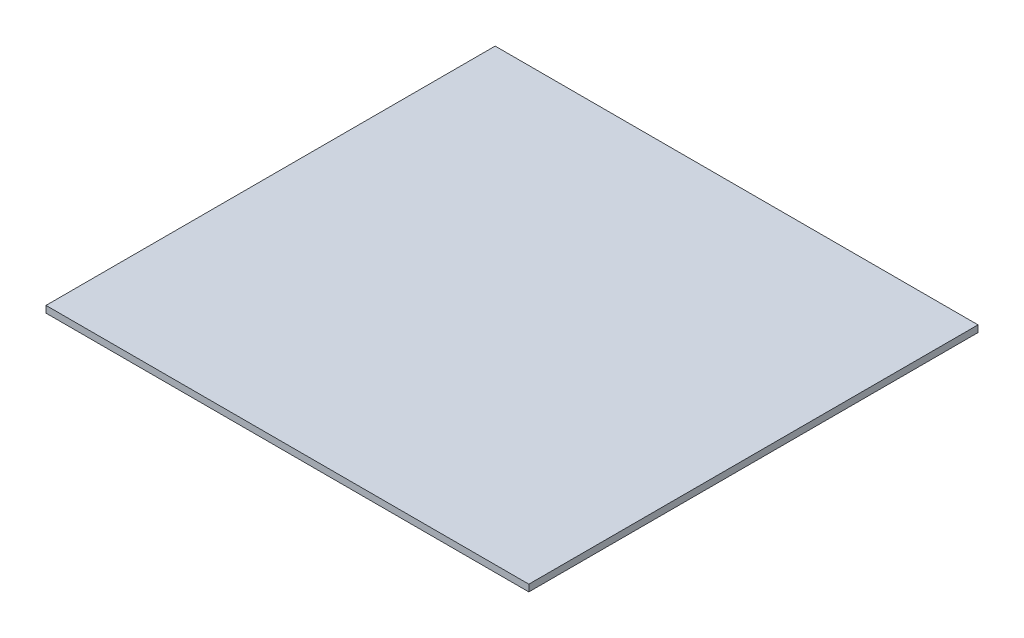
from build123d import *

# Parameters (mm, degrees)
SKETCH1_W           = 430
SKETCH1_H           = 400
BOSS_EXTRUDE1_DEPTH = 3


with BuildPart() as part:
    # Sketch1 → Boss-Extrude1 (new, symmetric)
    with BuildSketch(Plane(origin=(0, 0, 0), x_dir=(1, 0, 0), z_dir=(0, 1, 0))):
        Rectangle(SKETCH1_W, SKETCH1_H)
    extrude(amount=BOSS_EXTRUDE1_DEPTH, both=True)


solid = part.part
